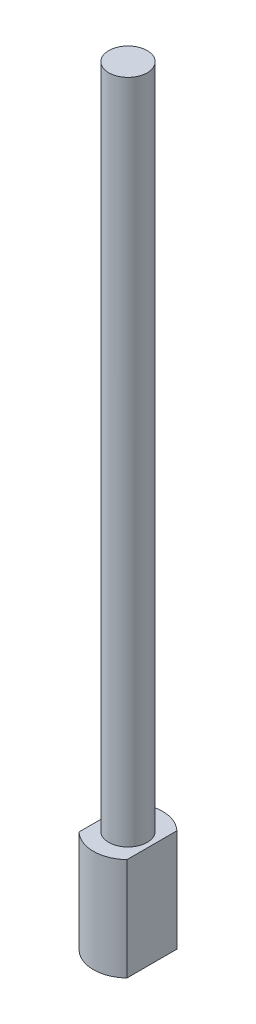
from build123d import *

# Parameters (mm, degrees)
SKETCH_1_R      = 1.5
EXTRUDE_1_DEPTH = 60
EXTRUDE_2_DEPTH = 8


with BuildPart() as part:
    # 草图1 → 凸台-拉伸1 (new body)
    with BuildSketch(Plane(origin=(0, 0, 0), x_dir=(1, 0, 0), z_dir=(0, 1, 0))):
        with Locations(Location((0, 0, 0), (0, 0, 270))):
            Circle(SKETCH_1_R)
    extrude(amount=EXTRUDE_1_DEPTH)

    # 草图2 → 凸台-拉伸2 (add)
    with BuildSketch(Plane.XZ):
        with BuildLine():
            Line((-1.87, -1.947588252), (-1.87, 1.947588252))
            ThreePointArc((-1.87, 1.947588252), (0, 2.7), (1.87, 1.947588252))
            Line((1.87, 1.947588252), (1.87, -1.947588252))
            ThreePointArc((1.87, -1.947588252), (0, -2.7), (-1.87, -1.947588252))
        make_face()
    extrude(amount=-EXTRUDE_2_DEPTH)


solid = part.part
